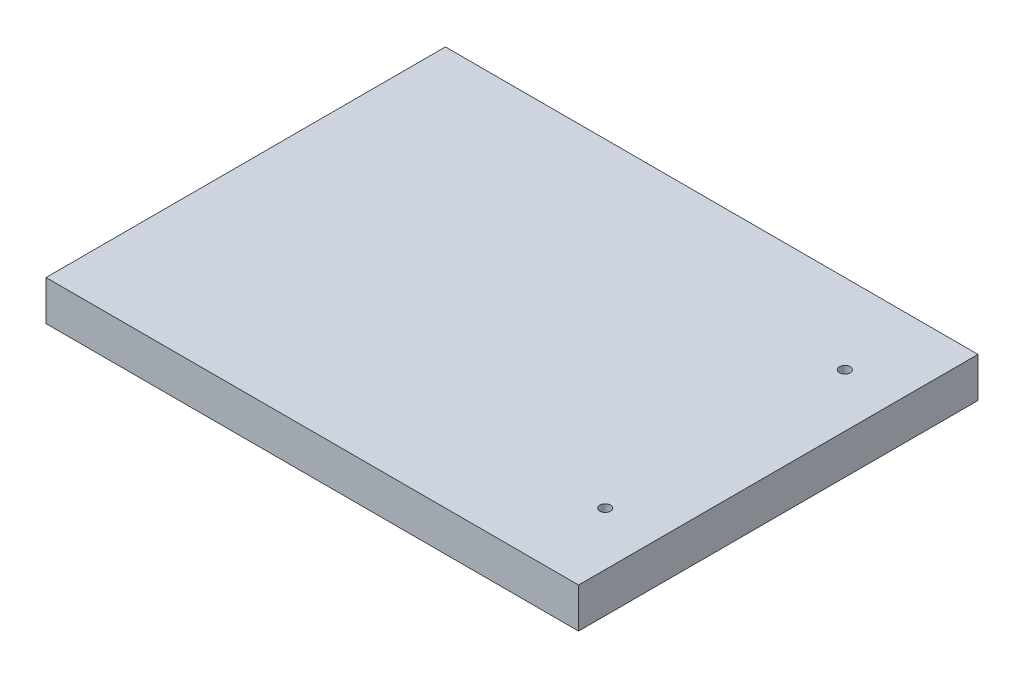
from build123d import *

# Parameters (mm, degrees)
SKETCH1_W                    = 200
SKETCH1_H                    = 150
BOSS_EXTRUDE1_DEPTH          = 15
F_4_0_4_DIAMETER_HOLE3_D     = 4
F_4_0_4_DIAMETER_HOLE3_DEPTH = 5.5
F_4_0_4_DIAMETER_HOLE3_TIP   = 1.201721238


with BuildPart() as part:
    # Sketch1 → Boss-Extrude1 (new body)
    with BuildSketch(Plane(origin=(0, 0, 0), x_dir=(1, 0, 0), z_dir=(0, 1, 0))):
        with Locations((100, 75)):
            Rectangle(SKETCH1_W, SKETCH1_H)
    extrude(amount=BOSS_EXTRUDE1_DEPTH)

    # Ø4.0 (4) Diameter Hole3
    with Locations(Plane(origin=(0, 15, 0), x_dir=(1, 0, 0), z_dir=(0, 1, 0))):
        with Locations((180, 120), (180, 30)):
            Hole(F_4_0_4_DIAMETER_HOLE3_D / 2, depth=F_4_0_4_DIAMETER_HOLE3_DEPTH)
            with Locations((0, 0, -(F_4_0_4_DIAMETER_HOLE3_DEPTH + F_4_0_4_DIAMETER_HOLE3_TIP / 2))):  # 118° drill point
                Cone(0, F_4_0_4_DIAMETER_HOLE3_D / 2, F_4_0_4_DIAMETER_HOLE3_TIP, mode=Mode.SUBTRACT)


solid = part.part
